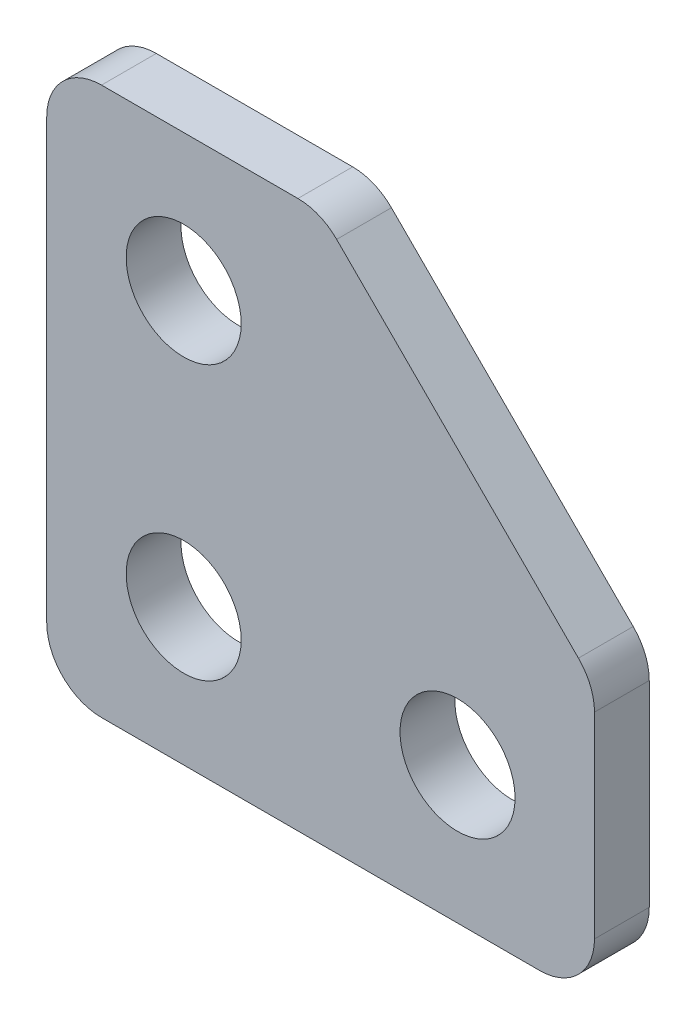
from build123d import *

# Parameters (mm, degrees)
SKETCH_1_W      = 10
SKETCH_1_H      = 10
SKETCH_1_R      = 2.1
EXTRUDE_1_DEPTH = 2
FILLET_1_R      = 2


with BuildPart() as part:
    # ｽｹｯﾁ1 → ﾎﾞｽ - 押し出し1 (new body)
    # profile 1 of 4: a face of its own
    with BuildSketch(Plane.XY):
        with Locations((0, 10)):
            Rectangle(SKETCH_1_W, SKETCH_1_H)
        with Locations((0, 10)):
            Circle(SKETCH_1_R, mode=Mode.SUBTRACT)
    # profile 2 of 4: a face of its own
    with BuildSketch(Plane.XY):
        Polygon((15, 5), (5, 15), (5, 5), align=None)
    # profile 3 of 4: a face of its own
    with BuildSketch(Plane.XY):
        Rectangle(SKETCH_1_W, SKETCH_1_H)
        Circle(SKETCH_1_R, mode=Mode.SUBTRACT)
    # profile 4 of 4: a face of its own
    with BuildSketch(Plane.XY):
        with Locations((10, 0)):
            Rectangle(SKETCH_1_W, SKETCH_1_H)
        with Locations((10, 0)):
            Circle(SKETCH_1_R, mode=Mode.SUBTRACT)
    extrude(amount=EXTRUDE_1_DEPTH)

    # ﾌｨﾚｯﾄ1
    fillet_1_edges = [part.edges().sort_by_distance(p)[0] for p in [
        (-5, -5, 1),
        (-5, 15, 1),
        (5, 15, 1),
        (15, 5, 1),
        (15, -5, 1),
    ]]
    fillet(fillet_1_edges, radius=FILLET_1_R)


solid = part.part
